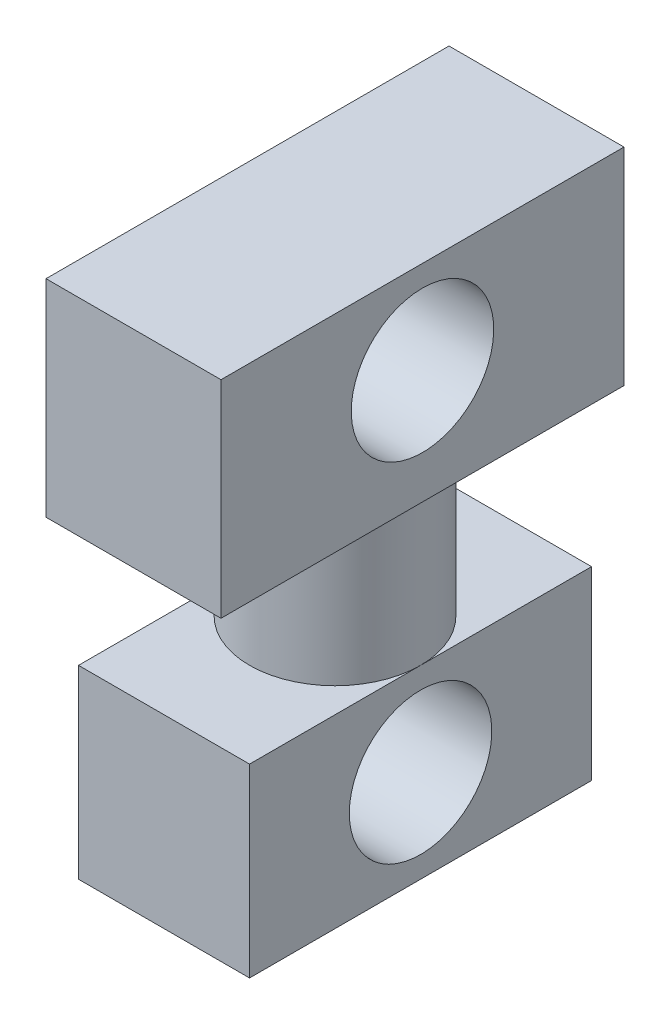
from build123d import *

# Parameters (mm, degrees)
SKETCH1_W           = 12.28
SKETCH1_H           = 14.5
BOSS_EXTRUDE1_DEPTH = 28.28
SKETCH2_R           = 5
CUT_EXTRUDE1_DEPTH  = 28.27
SKETCH3_R           = 6
BOSS_EXTRUDE2_DEPTH = 10
SKETCH4_R           = 6
BOSS_EXTRUDE3_DEPTH = 13
SKETCH5_R           = 5
CUT_EXTRUDE2_DEPTH  = 13


with BuildPart() as part:
    # Sketch1 → Boss-Extrude1 (new body)
    with BuildSketch(Plane.XY):
        with Locations((6.14, 27.98627451)):
            Rectangle(SKETCH1_W, SKETCH1_H)
    extrude(amount=BOSS_EXTRUDE1_DEPTH)

    # Sketch2 → Cut-Extrude1 (cut)
    with BuildSketch(Plane(origin=(12.28, 0, 0), x_dir=(0, 0, -1), z_dir=(1, 0, 0))):
        with Locations(Location((-14.14, 28.73627451, 0), (0, 0, 90))):
            Circle(SKETCH2_R)
    extrude(amount=-CUT_EXTRUDE1_DEPTH, mode=Mode.SUBTRACT)

    # Sketch3 → Boss-Extrude2 (add)
    with BuildSketch(Plane.XZ.offset(-20.73627451)):
        with Locations(Location((6.14, 14.14, 0), (0, 0, 270))):
            Circle(SKETCH3_R)
    extrude(amount=BOSS_EXTRUDE2_DEPTH)

    # Sketch4 → Boss-Extrude3 (add)
    # profile 1 of 2: a face of its own
    with BuildSketch(Plane.XZ.offset(-10.73627451)):
        Polygon((0.14, 26.14), (2.09119792, 26.14), (12.143195084, 26.14), (12.143195084, 2.14), (0.14, 2.14), (0.14, 14.14), align=None)
        with Locations(Location((6.14, 14.14, 0), (0, 0, 180))):
            Circle(SKETCH4_R, mode=Mode.SUBTRACT)
    # profile 2 of 2: a face of its own
    with BuildSketch(Plane.XZ.offset(-10.73627451)):
        with Locations(Location((6.14, 14.14, 0), (0, 0, 180))):
            Circle(SKETCH4_R)
    extrude(amount=BOSS_EXTRUDE3_DEPTH)

    # Sketch5 → Cut-Extrude2 (cut)
    with BuildSketch(Plane.ZY.offset(-0.14)):
        with Locations((14.14, 4.23627451)):
            Circle(SKETCH5_R)
    extrude(amount=-CUT_EXTRUDE2_DEPTH, mode=Mode.SUBTRACT)


solid = part.part
